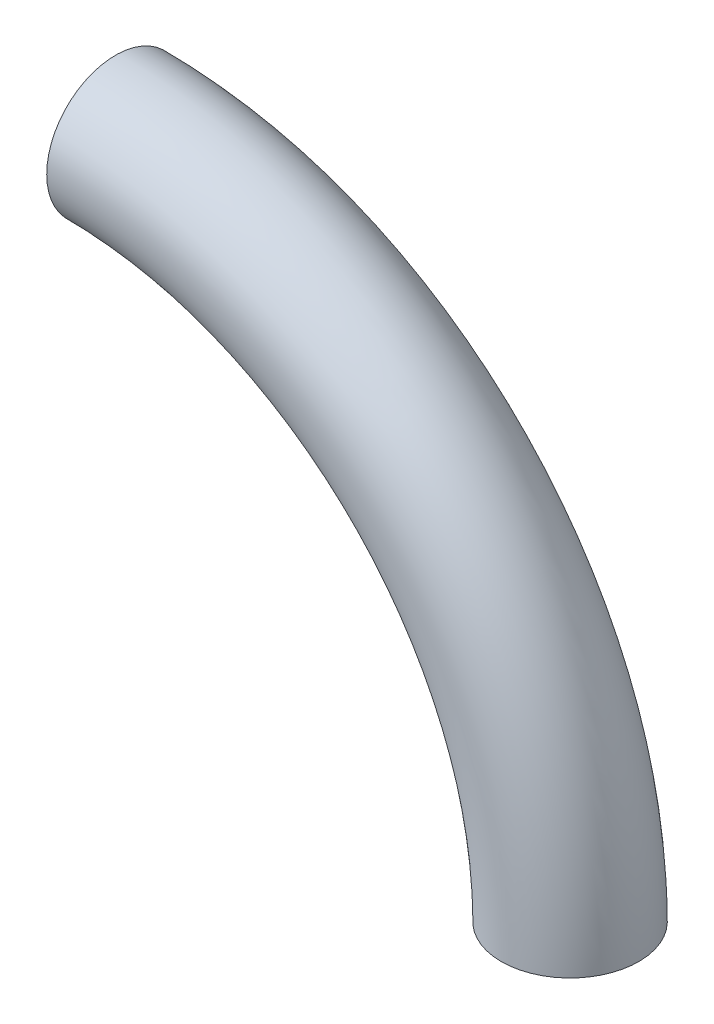
from build123d import *

# Parameters (mm, degrees)
SKETCH6_R = 7.650541804


with BuildPart() as part:
    # Sweep2: sweep along a path in Sketch5
    with BuildLine(Plane.XY) as sweep2_path:
        ThreePointArc((0, 50.57085527), (35.758994692, 35.758994692), (50.57085527, 0))
    # Sketch6 → Sweep2 (sweep)
    with BuildSketch(Plane(origin=(0, 0, 0), x_dir=(1, 0, 0), z_dir=(0, 1, 0))):
        with Locations((50.57085527, 0)):
            Circle(SKETCH6_R)
    sweep(path=sweep2_path.line)


solid = part.part
